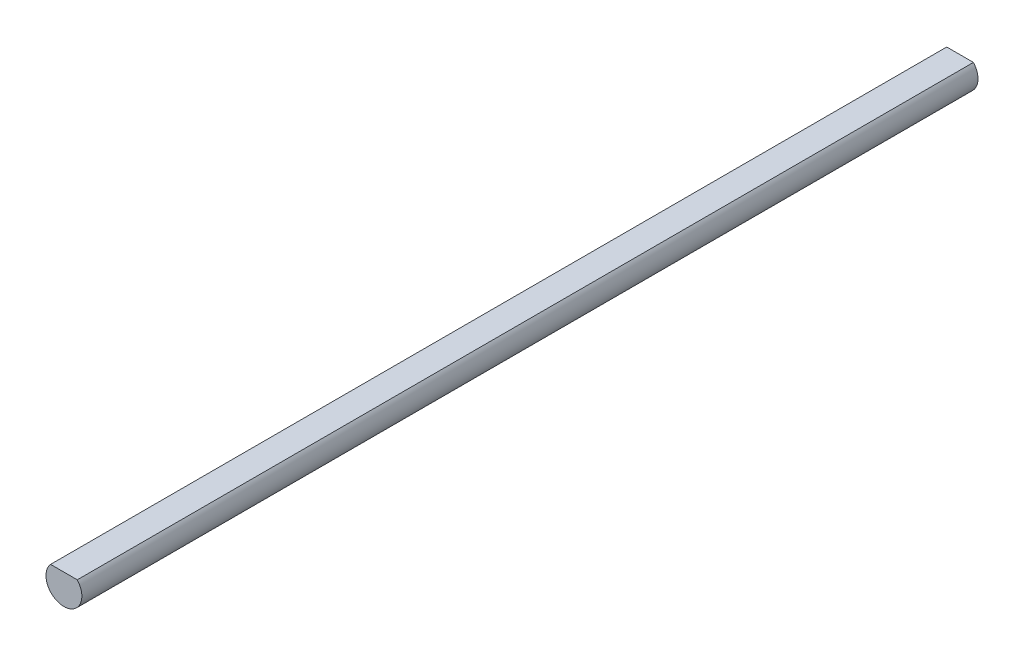
from build123d import *

# Parameters (mm, degrees)
SKETCH_1_R          = 6
EXTRUDE_1_DEPTH     = 300
CUT_EXTRUDE_1_DEPTH = 301.11997601


with BuildPart() as part:
    # 草图1 → 凸台-拉伸1 (new body)
    with BuildSketch(Plane.XY):
        Circle(SKETCH_1_R)
    extrude(amount=EXTRUDE_1_DEPTH)

    # 草图2 → 切除-拉伸1 (cut, through all)
    with BuildSketch(Plane.XY.offset(300)):
        with BuildLine():
            Line((-4.472135955, 4), (4.472135955, 4))
            ThreePointArc((4.472135955, 4), (0, 6), (-4.472135955, 4))
        make_face()
    extrude(amount=-CUT_EXTRUDE_1_DEPTH, mode=Mode.SUBTRACT)


solid = part.part
